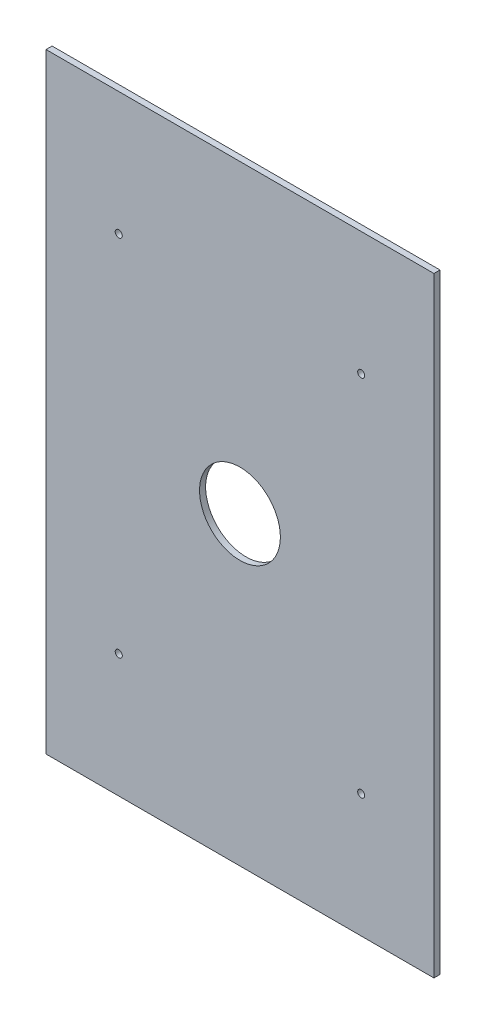
from build123d import *

# Parameters (mm, degrees)
SKETCH_1_W               = 384
SKETCH_1_H               = 604
RECESSED_TOP_SEAT_DEPTH  = 6
SKETCH_2_R               = 40
CENTRAL_ACCESS_DEPTH     = 716.756941985
SKETCH_3_R               = 3.5
FASTENER_CLEARANCE_DEPTH = 716.756941985
SKETCH_4_R               = 3.5
CUT_EXTRUDE_3_DEPTH      = 716.756941985
SKETCH_5_R               = 3.5
CUT_EXTRUDE_4_DEPTH      = 716.756941985
SKETCH_6_R               = 3.5
CUT_EXTRUDE_5_DEPTH      = 716.756941985


with BuildPart() as part:
    # 草图1 → Recessed_top_seat (new body)
    with BuildSketch(Plane.XY):
        with Locations((192, 302)):
            Rectangle(SKETCH_1_W, SKETCH_1_H)
    extrude(amount=RECESSED_TOP_SEAT_DEPTH)

    # 草图2 → Central_access (cut, through all)
    with BuildSketch(Plane.XY.offset(6)):
        with Locations((192, 302)):
            Circle(SKETCH_2_R)
    extrude(amount=-CENTRAL_ACCESS_DEPTH, mode=Mode.SUBTRACT)

    # 草图3 → Fastener_clearance (cut, through all)
    with BuildSketch(Plane.XY.offset(6)):
        with Locations((72, 122)):
            Circle(SKETCH_3_R)
    extrude(amount=-FASTENER_CLEARANCE_DEPTH, mode=Mode.SUBTRACT)

    # 草图4 → 切除-拉伸3 (cut, through all)
    with BuildSketch(Plane.XY.offset(6)):
        with Locations((72, 482)):
            Circle(SKETCH_4_R)
    extrude(amount=-CUT_EXTRUDE_3_DEPTH, mode=Mode.SUBTRACT)

    # 草图5 → 切除-拉伸4 (cut, through all)
    with BuildSketch(Plane.XY.offset(6)):
        with Locations((312, 122)):
            Circle(SKETCH_5_R)
    extrude(amount=-CUT_EXTRUDE_4_DEPTH, mode=Mode.SUBTRACT)

    # 草图6 → 切除-拉伸5 (cut, through all)
    with BuildSketch(Plane.XY.offset(6)):
        with Locations((312, 482)):
            Circle(SKETCH_6_R)
    extrude(amount=-CUT_EXTRUDE_5_DEPTH, mode=Mode.SUBTRACT)


solid = part.part
